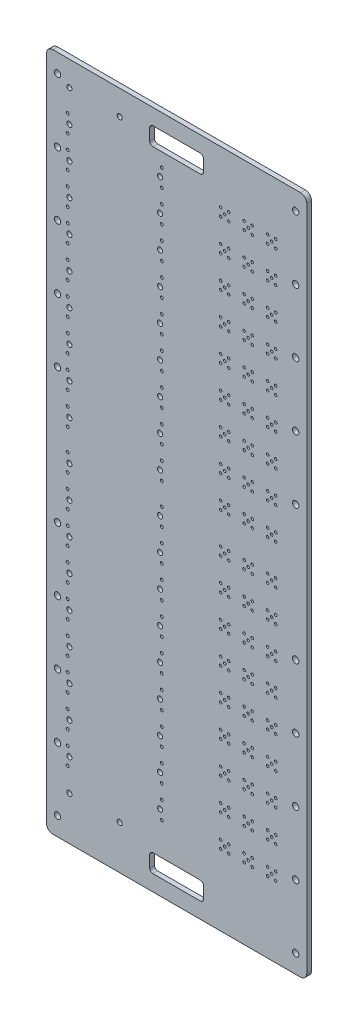
from build123d import *

# Parameters (mm, degrees)
SKETCH1_R           = 0.8
SKETCH1_R_2         = 0.45
SKETCH1_R_3         = 1
SKETCH1_R_4         = 0.4
BOSS_EXTRUDE1_DEPTH = 1.5


with BuildPart() as part:
    # Sketch1 → Boss-Extrude1 (new body)
    with BuildSketch(Plane(origin=(0, 0, 0), x_dir=(-1, 0, 0), z_dir=(0, 0, -1))):
        with BuildLine():
            Line((39, 107), (-39, 107))
            ThreePointArc((-39, 107), (-40.414213562, 106.414213562), (-41, 105))
            Line((-41, 105), (-41, -105))
            ThreePointArc((-41, -105), (-40.414213562, -106.414213562), (-39, -107))
            Line((-39, -107), (39, -107))
            ThreePointArc((39, -107), (40.414213562, -106.414213562), (41, -105))
            Line((41, -105), (41, 105))
            ThreePointArc((41, 105), (40.414213562, 106.414213562), (39, 107))
        make_face()
        with Locations(Location((5.225000014, -3.249999976, 0), (0, 0, 180))):
            Circle(SKETCH1_R, mode=Mode.SUBTRACT)
        with Locations(Location((34.325000016, -0.499999977, 0), (0, 0, 180))):
            Circle(SKETCH1_R_2, mode=Mode.SUBTRACT)
        with Locations(Location((-37.5, 101.2, 0), (0, 0, 180))):
            Circle(SKETCH1_R_3, mode=Mode.SUBTRACT)
        with Locations(Location((34.325000016, -5.999999976, 0), (0, 0, 180))):
            Circle(SKETCH1_R_2, mode=Mode.SUBTRACT)
        with Locations(Location((34.325000016, 46.500000023, 0), (0, 0, 180))):
            Circle(SKETCH1_R_2, mode=Mode.SUBTRACT)
        with Locations(Location((4.675000014, -5.999999976, 0), (0, 0, 180))):
            Circle(SKETCH1_R_2, mode=Mode.SUBTRACT)
        with Locations(Location((5.225000014, 79.250000024, 0), (0, 0, 180))):
            Circle(SKETCH1_R, mode=Mode.SUBTRACT)
        with Locations(Location((34.325000016, 82.000000023, 0), (0, 0, 180))):
            Circle(SKETCH1_R_2, mode=Mode.SUBTRACT)
        with Locations(Location((33.775000015, 19.250000024, 0), (0, 0, 180))):
            Circle(SKETCH1_R, mode=Mode.SUBTRACT)
        with Locations(Location((33.775000015, -3.249999976, 0), (0, 0, 180))):
            Circle(SKETCH1_R, mode=Mode.SUBTRACT)
        with Locations(Location((34.325000016, 26.500000023, 0), (0, 0, 180))):
            Circle(SKETCH1_R_2, mode=Mode.SUBTRACT)
        with Locations(Location((4.675000014, -0.499999977, 0), (0, 0, 180))):
            Circle(SKETCH1_R_2, mode=Mode.SUBTRACT)
        with Locations(Location((5.225000014, -13.249999976, 0), (0, 0, 180))):
            Circle(SKETCH1_R, mode=Mode.SUBTRACT)
        with Locations(Location((5.225000014, 29.250000023, 0), (0, 0, 180))):
            Circle(SKETCH1_R, mode=Mode.SUBTRACT)
        with Locations(Location((34.325000016, -10.499999977, 0), (0, 0, 180))):
            Circle(SKETCH1_R_2, mode=Mode.SUBTRACT)
        with Locations(Location((34.325000016, 36.500000023, 0), (0, 0, 180))):
            Circle(SKETCH1_R_2, mode=Mode.SUBTRACT)
        with Locations(Location((4.675000014, 22.000000023, 0), (0, 0, 180))):
            Circle(SKETCH1_R_2, mode=Mode.SUBTRACT)
        with Locations(Location((34.325000016, -15.999999976, 0), (0, 0, 180))):
            Circle(SKETCH1_R_2, mode=Mode.SUBTRACT)
        with Locations(Location((5.225000014, 19.250000023, 0), (0, 0, 180))):
            Circle(SKETCH1_R, mode=Mode.SUBTRACT)
        with Locations(Location((4.675000014, -15.999999976, 0), (0, 0, 180))):
            Circle(SKETCH1_R_2, mode=Mode.SUBTRACT)
        with Locations(Location((33.775000015, -13.249999976, 0), (0, 0, 180))):
            Circle(SKETCH1_R, mode=Mode.SUBTRACT)
        with Locations(Location((34.325000016, 76.500000024, 0), (0, 0, 180))):
            Circle(SKETCH1_R_2, mode=Mode.SUBTRACT)
        with Locations(Location((5.225000014, 89.250000024, 0), (0, 0, 180))):
            Circle(SKETCH1_R, mode=Mode.SUBTRACT)
        with Locations(Location((4.675000014, -10.499999977, 0), (0, 0, 180))):
            Circle(SKETCH1_R_2, mode=Mode.SUBTRACT)
        with Locations(Location((5.225000014, -23.249999976, 0), (0, 0, 180))):
            Circle(SKETCH1_R, mode=Mode.SUBTRACT)
        with Locations(Location((34.325000016, -20.499999977, 0), (0, 0, 180))):
            Circle(SKETCH1_R_2, mode=Mode.SUBTRACT)
        with Locations(Location((4.675000014, 76.500000024, 0), (0, 0, 180))):
            Circle(SKETCH1_R_2, mode=Mode.SUBTRACT)
        with Locations(Location((33.775000015, 79.250000024, 0), (0, 0, 180))):
            Circle(SKETCH1_R, mode=Mode.SUBTRACT)
        with Locations(Location((34.325000016, 32.000000023, 0), (0, 0, 180))):
            Circle(SKETCH1_R_2, mode=Mode.SUBTRACT)
        with Locations(Location((34.325000016, -25.999999976, 0), (0, 0, 180))):
            Circle(SKETCH1_R_2, mode=Mode.SUBTRACT)
        with Locations(Location((4.675000014, 46.500000023, 0), (0, 0, 180))):
            Circle(SKETCH1_R_2, mode=Mode.SUBTRACT)
        with Locations(Location((4.675000014, 26.500000023, 0), (0, 0, 180))):
            Circle(SKETCH1_R_2, mode=Mode.SUBTRACT)
        with Locations(Location((4.675000014, -25.999999976, 0), (0, 0, 180))):
            Circle(SKETCH1_R_2, mode=Mode.SUBTRACT)
        with Locations(Location((33.775000015, -23.249999976, 0), (0, 0, 180))):
            Circle(SKETCH1_R, mode=Mode.SUBTRACT)
        with Locations(Location((4.675000014, -20.499999977, 0), (0, 0, 180))):
            Circle(SKETCH1_R_2, mode=Mode.SUBTRACT)
        with Locations(Location((5.225000014, -33.249999976, 0), (0, 0, 180))):
            Circle(SKETCH1_R, mode=Mode.SUBTRACT)
        with Locations(Location((34.325000016, -30.499999977, 0), (0, 0, 180))):
            Circle(SKETCH1_R_2, mode=Mode.SUBTRACT)
        with Locations(Location((34.325000016, -35.999999976, 0), (0, 0, 180))):
            Circle(SKETCH1_R_2, mode=Mode.SUBTRACT)
        with Locations(Location((34.325000016, 92.000000023, 0), (0, 0, 180))):
            Circle(SKETCH1_R_2, mode=Mode.SUBTRACT)
        with Locations(Location((33.775000015, -93.249999976, 0), (0, 0, 180))):
            Circle(SKETCH1_R, mode=Mode.SUBTRACT)
        with Locations(Location((4.675000014, 32.000000023, 0), (0, 0, 180))):
            Circle(SKETCH1_R_2, mode=Mode.SUBTRACT)
        with Locations(Location((4.675000014, 16.500000023, 0), (0, 0, 180))):
            Circle(SKETCH1_R_2, mode=Mode.SUBTRACT)
        with Locations(Location((4.675000014, -35.999999976, 0), (0, 0, 180))):
            Circle(SKETCH1_R_2, mode=Mode.SUBTRACT)
        with Locations(Location((4.675000014, 82.000000023, 0), (0, 0, 180))):
            Circle(SKETCH1_R_2, mode=Mode.SUBTRACT)
        with Locations(Location((5.225000014, 69.250000024, 0), (0, 0, 180))):
            Circle(SKETCH1_R, mode=Mode.SUBTRACT)
        with Locations(Location((34.325000016, 16.500000023, 0), (0, 0, 180))):
            Circle(SKETCH1_R_2, mode=Mode.SUBTRACT)
        with Locations(Location((33.775000015, -33.249999976, 0), (0, 0, 180))):
            Circle(SKETCH1_R, mode=Mode.SUBTRACT)
        with Locations(Location((4.675000014, -30.499999977, 0), (0, 0, 180))):
            Circle(SKETCH1_R_2, mode=Mode.SUBTRACT)
        with Locations(Location((4.675000014, 36.500000023, 0), (0, 0, 180))):
            Circle(SKETCH1_R_2, mode=Mode.SUBTRACT)
        with Locations(Location((5.225000014, -43.249999976, 0), (0, 0, 180))):
            Circle(SKETCH1_R, mode=Mode.SUBTRACT)
        with Locations(Location((34.325000016, 86.500000024, 0), (0, 0, 180))):
            Circle(SKETCH1_R_2, mode=Mode.SUBTRACT)
        with Locations(Location((33.775000015, 29.250000024, 0), (0, 0, 180))):
            Circle(SKETCH1_R, mode=Mode.SUBTRACT)
        with Locations(Location((34.325000016, -40.499999977, 0), (0, 0, 180))):
            Circle(SKETCH1_R_2, mode=Mode.SUBTRACT)
        with Locations(Location((34.325000016, -45.999999976, 0), (0, 0, 180))):
            Circle(SKETCH1_R_2, mode=Mode.SUBTRACT)
        with Locations(Location((4.675000014, -45.999999976, 0), (0, 0, 180))):
            Circle(SKETCH1_R_2, mode=Mode.SUBTRACT)
        with Locations(Location((33.775000015, 39.250000024, 0), (0, 0, 180))):
            Circle(SKETCH1_R, mode=Mode.SUBTRACT)
        with Locations(Location((34.325000016, 72.000000023, 0), (0, 0, 180))):
            Circle(SKETCH1_R_2, mode=Mode.SUBTRACT)
        with Locations(Location((34.325000016, 12.000000023, 0), (0, 0, 180))):
            Circle(SKETCH1_R_2, mode=Mode.SUBTRACT)
        with Locations(Location((33.775000015, -43.249999976, 0), (0, 0, 180))):
            Circle(SKETCH1_R, mode=Mode.SUBTRACT)
        with Locations(Location((4.675000014, -40.499999977, 0), (0, 0, 180))):
            Circle(SKETCH1_R_2, mode=Mode.SUBTRACT)
        with Locations(Location((34.325000016, 66.500000024, 0), (0, 0, 180))):
            Circle(SKETCH1_R_2, mode=Mode.SUBTRACT)
        with Locations(Location((5.225000014, -53.249999976, 0), (0, 0, 180))):
            Circle(SKETCH1_R, mode=Mode.SUBTRACT)
        with Locations(Location((33.775000015, 9.250000024, 0), (0, 0, 180))):
            Circle(SKETCH1_R, mode=Mode.SUBTRACT)
        with Locations(Location((34.325000016, -50.499999977, 0), (0, 0, 180))):
            Circle(SKETCH1_R_2, mode=Mode.SUBTRACT)
        with Locations(Location((34.325000016, -55.999999976, 0), (0, 0, 180))):
            Circle(SKETCH1_R_2, mode=Mode.SUBTRACT)
        with Locations(Location((4.675000014, -55.999999976, 0), (0, 0, 180))):
            Circle(SKETCH1_R_2, mode=Mode.SUBTRACT)
        with Locations(Location((33.775000015, -53.249999976, 0), (0, 0, 180))):
            Circle(SKETCH1_R, mode=Mode.SUBTRACT)
        with Locations(Location((4.675000014, 66.500000024, 0), (0, 0, 180))):
            Circle(SKETCH1_R_2, mode=Mode.SUBTRACT)
        with Locations(Location((4.675000014, -50.499999977, 0), (0, 0, 180))):
            Circle(SKETCH1_R_2, mode=Mode.SUBTRACT)
        with Locations(Location((33.775000015, 99.250000024, 0), (0, 0, 180))):
            Circle(SKETCH1_R, mode=Mode.SUBTRACT)
        with Locations(Location((5.225000014, -63.249999976, 0), (0, 0, 180))):
            Circle(SKETCH1_R, mode=Mode.SUBTRACT)
        with Locations(Location((33.775000015, 69.250000024, 0), (0, 0, 180))):
            Circle(SKETCH1_R, mode=Mode.SUBTRACT)
        with Locations(Location((-37.5, 21.2, 0), (0, 0, 180))):
            Circle(SKETCH1_R_3, mode=Mode.SUBTRACT)
        with Locations(Location((4.675000014, 72.000000023, 0), (0, 0, 180))):
            Circle(SKETCH1_R_2, mode=Mode.SUBTRACT)
        with Locations(Location((34.325000016, -60.499999977, 0), (0, 0, 180))):
            Circle(SKETCH1_R_2, mode=Mode.SUBTRACT)
        with Locations(Location((5.225000014, 59.250000024, 0), (0, 0, 180))):
            Circle(SKETCH1_R, mode=Mode.SUBTRACT)
        with Locations(Location((4.675000014, 86.500000024, 0), (0, 0, 180))):
            Circle(SKETCH1_R_2, mode=Mode.SUBTRACT)
        with Locations(Location((34.325000016, -65.999999976, 0), (0, 0, 180))):
            Circle(SKETCH1_R_2, mode=Mode.SUBTRACT)
        with Locations(Location((4.675000014, 6.500000023, 0), (0, 0, 180))):
            Circle(SKETCH1_R_2, mode=Mode.SUBTRACT)
        with Locations(Location((34.325000016, 62.000000023, 0), (0, 0, 180))):
            Circle(SKETCH1_R_2, mode=Mode.SUBTRACT)
        with Locations(Location((4.675000014, -65.999999976, 0), (0, 0, 180))):
            Circle(SKETCH1_R_2, mode=Mode.SUBTRACT)
        with Locations(Location((33.775000015, -63.249999976, 0), (0, 0, 180))):
            Circle(SKETCH1_R, mode=Mode.SUBTRACT)
        with Locations(Location((4.675000014, 42.000000023, 0), (0, 0, 180))):
            Circle(SKETCH1_R_2, mode=Mode.SUBTRACT)
        with Locations(Location((4.675000014, -60.499999977, 0), (0, 0, 180))):
            Circle(SKETCH1_R_2, mode=Mode.SUBTRACT)
        with Locations(Location((34.325000016, 56.500000024, 0), (0, 0, 180))):
            Circle(SKETCH1_R_2, mode=Mode.SUBTRACT)
        with Locations(Location((4.675000014, 56.500000024, 0), (0, 0, 180))):
            Circle(SKETCH1_R_2, mode=Mode.SUBTRACT)
        with Locations(Location((5.225000014, -73.249999976, 0), (0, 0, 180))):
            Circle(SKETCH1_R, mode=Mode.SUBTRACT)
        with Locations(Location((33.775000015, 89.250000024, 0), (0, 0, 180))):
            Circle(SKETCH1_R, mode=Mode.SUBTRACT)
        with Locations(Location((17.925000011, -93.249999976, 0), (0, 0, 180))):
            Circle(SKETCH1_R, mode=Mode.SUBTRACT)
        with Locations(Location((34.325000016, 22.000000023, 0), (0, 0, 180))):
            Circle(SKETCH1_R_2, mode=Mode.SUBTRACT)
        with Locations(Location((33.775000015, 59.250000024, 0), (0, 0, 180))):
            Circle(SKETCH1_R, mode=Mode.SUBTRACT)
        with Locations(Location((17.925000011, 99.250000024, 0), (0, 0, 180))):
            Circle(SKETCH1_R, mode=Mode.SUBTRACT)
        with Locations(Location((4.675000014, 12.000000023, 0), (0, 0, 180))):
            Circle(SKETCH1_R_2, mode=Mode.SUBTRACT)
        with Locations(Location((34.325000016, -70.499999977, 0), (0, 0, 180))):
            Circle(SKETCH1_R_2, mode=Mode.SUBTRACT)
        with Locations(Location((4.675000014, 62.000000023, 0), (0, 0, 180))):
            Circle(SKETCH1_R_2, mode=Mode.SUBTRACT)
        with Locations(Location((34.325000016, -75.999999976, 0), (0, 0, 180))):
            Circle(SKETCH1_R_2, mode=Mode.SUBTRACT)
        with Locations(Location((4.675000014, -75.999999976, 0), (0, 0, 180))):
            Circle(SKETCH1_R_2, mode=Mode.SUBTRACT)
        with Locations(Location((5.225000014, 39.250000023, 0), (0, 0, 180))):
            Circle(SKETCH1_R, mode=Mode.SUBTRACT)
        with Locations(Location((33.775000015, -73.249999976, 0), (0, 0, 180))):
            Circle(SKETCH1_R, mode=Mode.SUBTRACT)
        with Locations(Location((4.675000014, -70.499999977, 0), (0, 0, 180))):
            Circle(SKETCH1_R_2, mode=Mode.SUBTRACT)
        with Locations(Location((-21.27, -12.07885, 0), (0, 0, 180))):
            Circle(SKETCH1_R_4, mode=Mode.SUBTRACT)
        with Locations(Location((-23.81, -12.07885, 0), (0, 0, 180))):
            Circle(SKETCH1_R_4, mode=Mode.SUBTRACT)
        with Locations(Location((-23.81, -14.61885, 0), (0, 0, 180))):
            Circle(SKETCH1_R_4, mode=Mode.SUBTRACT)
        with Locations(Location((-22.54, -13.34885, 0), (0, 0, 180))):
            Circle(SKETCH1_R_4, mode=Mode.SUBTRACT)
        with Locations(Location((-21.27, -14.61885, 0), (0, 0, 180))):
            Circle(SKETCH1_R_4, mode=Mode.SUBTRACT)
        with Locations(Location((37.5, -21.2, 0), (0, 0, 180))):
            Circle(SKETCH1_R_3, mode=Mode.SUBTRACT)
        with Locations(Location((-28.67, -12.07885, 0), (0, 0, 180))):
            Circle(SKETCH1_R_4, mode=Mode.SUBTRACT)
        with Locations(Location((-31.21, -12.07885, 0), (0, 0, 180))):
            Circle(SKETCH1_R_4, mode=Mode.SUBTRACT)
        with Locations(Location((-31.21, -14.61885, 0), (0, 0, 180))):
            Circle(SKETCH1_R_4, mode=Mode.SUBTRACT)
        with Locations(Location((-29.94, -13.34885, 0), (0, 0, 180))):
            Circle(SKETCH1_R_4, mode=Mode.SUBTRACT)
        with Locations(Location((-28.67, -14.61885, 0), (0, 0, 180))):
            Circle(SKETCH1_R_4, mode=Mode.SUBTRACT)
        with Locations(Location((-13.87, -12.07885, 0), (0, 0, 180))):
            Circle(SKETCH1_R_4, mode=Mode.SUBTRACT)
        with Locations(Location((-16.41, -12.07885, 0), (0, 0, 180))):
            Circle(SKETCH1_R_4, mode=Mode.SUBTRACT)
        with Locations(Location((-16.41, -14.61885, 0), (0, 0, 180))):
            Circle(SKETCH1_R_4, mode=Mode.SUBTRACT)
        with Locations(Location((-15.14, -13.34885, 0), (0, 0, 180))):
            Circle(SKETCH1_R_4, mode=Mode.SUBTRACT)
        with Locations(Location((-13.87, -14.61885, 0), (0, 0, 180))):
            Circle(SKETCH1_R_4, mode=Mode.SUBTRACT)
        with Locations(Location((-21.27, -22.07885, 0), (0, 0, 180))):
            Circle(SKETCH1_R_4, mode=Mode.SUBTRACT)
        with Locations(Location((-23.81, -22.07885, 0), (0, 0, 180))):
            Circle(SKETCH1_R_4, mode=Mode.SUBTRACT)
        with Locations(Location((-23.81, -24.61885, 0), (0, 0, 180))):
            Circle(SKETCH1_R_4, mode=Mode.SUBTRACT)
        with Locations(Location((-22.54, -23.34885, 0), (0, 0, 180))):
            Circle(SKETCH1_R_4, mode=Mode.SUBTRACT)
        with Locations(Location((-21.27, -24.61885, 0), (0, 0, 180))):
            Circle(SKETCH1_R_4, mode=Mode.SUBTRACT)
        with Locations(Location((-28.67, -22.07885, 0), (0, 0, 180))):
            Circle(SKETCH1_R_4, mode=Mode.SUBTRACT)
        with Locations(Location((-31.21, -22.07885, 0), (0, 0, 180))):
            Circle(SKETCH1_R_4, mode=Mode.SUBTRACT)
        with Locations(Location((-31.21, -24.61885, 0), (0, 0, 180))):
            Circle(SKETCH1_R_4, mode=Mode.SUBTRACT)
        with Locations(Location((-29.94, -23.34885, 0), (0, 0, 180))):
            Circle(SKETCH1_R_4, mode=Mode.SUBTRACT)
        with Locations(Location((-28.67, -24.61885, 0), (0, 0, 180))):
            Circle(SKETCH1_R_4, mode=Mode.SUBTRACT)
        with Locations(Location((-13.87, -22.07885, 0), (0, 0, 180))):
            Circle(SKETCH1_R_4, mode=Mode.SUBTRACT)
        with Locations(Location((-16.41, -22.07885, 0), (0, 0, 180))):
            Circle(SKETCH1_R_4, mode=Mode.SUBTRACT)
        with Locations(Location((-16.41, -24.61885, 0), (0, 0, 180))):
            Circle(SKETCH1_R_4, mode=Mode.SUBTRACT)
        with Locations(Location((-15.14, -23.34885, 0), (0, 0, 180))):
            Circle(SKETCH1_R_4, mode=Mode.SUBTRACT)
        with Locations(Location((-13.87, -24.61885, 0), (0, 0, 180))):
            Circle(SKETCH1_R_4, mode=Mode.SUBTRACT)
        with Locations(Location((-21.27, -32.07885, 0), (0, 0, 180))):
            Circle(SKETCH1_R_4, mode=Mode.SUBTRACT)
        with Locations(Location((-23.81, -32.07885, 0), (0, 0, 180))):
            Circle(SKETCH1_R_4, mode=Mode.SUBTRACT)
        with Locations(Location((-23.81, -34.61885, 0), (0, 0, 180))):
            Circle(SKETCH1_R_4, mode=Mode.SUBTRACT)
        with Locations(Location((-22.54, -33.34885, 0), (0, 0, 180))):
            Circle(SKETCH1_R_4, mode=Mode.SUBTRACT)
        with Locations(Location((-21.27, -34.61885, 0), (0, 0, 180))):
            Circle(SKETCH1_R_4, mode=Mode.SUBTRACT)
        with Locations(Location((-28.67, -32.07885, 0), (0, 0, 180))):
            Circle(SKETCH1_R_4, mode=Mode.SUBTRACT)
        with Locations(Location((-31.21, -32.07885, 0), (0, 0, 180))):
            Circle(SKETCH1_R_4, mode=Mode.SUBTRACT)
        with Locations(Location((-31.21, -34.61885, 0), (0, 0, 180))):
            Circle(SKETCH1_R_4, mode=Mode.SUBTRACT)
        with Locations(Location((-29.94, -33.34885, 0), (0, 0, 180))):
            Circle(SKETCH1_R_4, mode=Mode.SUBTRACT)
        with Locations(Location((-28.67, -34.61885, 0), (0, 0, 180))):
            Circle(SKETCH1_R_4, mode=Mode.SUBTRACT)
        with Locations(Location((-13.87, -32.07885, 0), (0, 0, 180))):
            Circle(SKETCH1_R_4, mode=Mode.SUBTRACT)
        with Locations(Location((-16.41, -32.07885, 0), (0, 0, 180))):
            Circle(SKETCH1_R_4, mode=Mode.SUBTRACT)
        with Locations(Location((-16.41, -34.61885, 0), (0, 0, 180))):
            Circle(SKETCH1_R_4, mode=Mode.SUBTRACT)
        with Locations(Location((-15.14, -33.34885, 0), (0, 0, 180))):
            Circle(SKETCH1_R_4, mode=Mode.SUBTRACT)
        with Locations(Location((-13.87, -34.61885, 0), (0, 0, 180))):
            Circle(SKETCH1_R_4, mode=Mode.SUBTRACT)
        with Locations(Location((-21.27, -42.07885, 0), (0, 0, 180))):
            Circle(SKETCH1_R_4, mode=Mode.SUBTRACT)
        with Locations(Location((-23.81, -42.07885, 0), (0, 0, 180))):
            Circle(SKETCH1_R_4, mode=Mode.SUBTRACT)
        with Locations(Location((-23.81, -44.61885, 0), (0, 0, 180))):
            Circle(SKETCH1_R_4, mode=Mode.SUBTRACT)
        with Locations(Location((-22.54, -43.34885, 0), (0, 0, 180))):
            Circle(SKETCH1_R_4, mode=Mode.SUBTRACT)
        with Locations(Location((-21.27, -44.61885, 0), (0, 0, 180))):
            Circle(SKETCH1_R_4, mode=Mode.SUBTRACT)
        with Locations(Location((-28.67, -42.07885, 0), (0, 0, 180))):
            Circle(SKETCH1_R_4, mode=Mode.SUBTRACT)
        with Locations(Location((-31.21, -42.07885, 0), (0, 0, 180))):
            Circle(SKETCH1_R_4, mode=Mode.SUBTRACT)
        with Locations(Location((-31.21, -44.61885, 0), (0, 0, 180))):
            Circle(SKETCH1_R_4, mode=Mode.SUBTRACT)
        with Locations(Location((-29.94, -43.34885, 0), (0, 0, 180))):
            Circle(SKETCH1_R_4, mode=Mode.SUBTRACT)
        with Locations(Location((-21.27, 80.42115, 0), (0, 0, 180))):
            Circle(SKETCH1_R_4, mode=Mode.SUBTRACT)
        with Locations(Location((-23.81, 80.42115, 0), (0, 0, 180))):
            Circle(SKETCH1_R_4, mode=Mode.SUBTRACT)
        with Locations(Location((-23.81, 77.88115, 0), (0, 0, 180))):
            Circle(SKETCH1_R_4, mode=Mode.SUBTRACT)
        with Locations(Location((-22.54, 79.15115, 0), (0, 0, 180))):
            Circle(SKETCH1_R_4, mode=Mode.SUBTRACT)
        with Locations(Location((-21.27, 77.88115, 0), (0, 0, 180))):
            Circle(SKETCH1_R_4, mode=Mode.SUBTRACT)
        with Locations(Location((-28.67, 80.42115, 0), (0, 0, 180))):
            Circle(SKETCH1_R_4, mode=Mode.SUBTRACT)
        with Locations(Location((-31.21, 80.42115, 0), (0, 0, 180))):
            Circle(SKETCH1_R_4, mode=Mode.SUBTRACT)
        with Locations(Location((-31.21, 77.88115, 0), (0, 0, 180))):
            Circle(SKETCH1_R_4, mode=Mode.SUBTRACT)
        with Locations(Location((-29.94, 79.15115, 0), (0, 0, 180))):
            Circle(SKETCH1_R_4, mode=Mode.SUBTRACT)
        with Locations(Location((-28.67, 77.88115, 0), (0, 0, 180))):
            Circle(SKETCH1_R_4, mode=Mode.SUBTRACT)
        with Locations(Location((-28.67, -44.61885, 0), (0, 0, 180))):
            Circle(SKETCH1_R_4, mode=Mode.SUBTRACT)
        with Locations(Location((-13.87, -42.07885, 0), (0, 0, 180))):
            Circle(SKETCH1_R_4, mode=Mode.SUBTRACT)
        with Locations(Location((-16.41, -42.07885, 0), (0, 0, 180))):
            Circle(SKETCH1_R_4, mode=Mode.SUBTRACT)
        with Locations(Location((-16.41, -44.61885, 0), (0, 0, 180))):
            Circle(SKETCH1_R_4, mode=Mode.SUBTRACT)
        with Locations(Location((-15.14, -43.34885, 0), (0, 0, 180))):
            Circle(SKETCH1_R_4, mode=Mode.SUBTRACT)
        with Locations(Location((-13.87, -44.61885, 0), (0, 0, 180))):
            Circle(SKETCH1_R_4, mode=Mode.SUBTRACT)
        with Locations(Location((-21.27, -52.07885, 0), (0, 0, 180))):
            Circle(SKETCH1_R_4, mode=Mode.SUBTRACT)
        with Locations(Location((-23.81, -52.07885, 0), (0, 0, 180))):
            Circle(SKETCH1_R_4, mode=Mode.SUBTRACT)
        with Locations(Location((-23.81, -54.61885, 0), (0, 0, 180))):
            Circle(SKETCH1_R_4, mode=Mode.SUBTRACT)
        with Locations(Location((-22.54, -53.34885, 0), (0, 0, 180))):
            Circle(SKETCH1_R_4, mode=Mode.SUBTRACT)
        with Locations(Location((-21.27, -54.61885, 0), (0, 0, 180))):
            Circle(SKETCH1_R_4, mode=Mode.SUBTRACT)
        with Locations(Location((-28.67, -52.07885, 0), (0, 0, 180))):
            Circle(SKETCH1_R_4, mode=Mode.SUBTRACT)
        with Locations(Location((-31.21, -52.07885, 0), (0, 0, 180))):
            Circle(SKETCH1_R_4, mode=Mode.SUBTRACT)
        with Locations(Location((-31.21, -54.61885, 0), (0, 0, 180))):
            Circle(SKETCH1_R_4, mode=Mode.SUBTRACT)
        with Locations(Location((-29.94, -53.34885, 0), (0, 0, 180))):
            Circle(SKETCH1_R_4, mode=Mode.SUBTRACT)
        with Locations(Location((-13.87, 80.42115, 0), (0, 0, 180))):
            Circle(SKETCH1_R_4, mode=Mode.SUBTRACT)
        with Locations(Location((-16.41, 80.42115, 0), (0, 0, 180))):
            Circle(SKETCH1_R_4, mode=Mode.SUBTRACT)
        with Locations(Location((-16.41, 77.88115, 0), (0, 0, 180))):
            Circle(SKETCH1_R_4, mode=Mode.SUBTRACT)
        with Locations(Location((-15.14, 79.15115, 0), (0, 0, 180))):
            Circle(SKETCH1_R_4, mode=Mode.SUBTRACT)
        with Locations(Location((-13.87, 77.88115, 0), (0, 0, 180))):
            Circle(SKETCH1_R_4, mode=Mode.SUBTRACT)
        with Locations(Location((-21.27, 70.42115, 0), (0, 0, 180))):
            Circle(SKETCH1_R_4, mode=Mode.SUBTRACT)
        with Locations(Location((-23.81, 70.42115, 0), (0, 0, 180))):
            Circle(SKETCH1_R_4, mode=Mode.SUBTRACT)
        with Locations(Location((-23.81, 67.88115, 0), (0, 0, 180))):
            Circle(SKETCH1_R_4, mode=Mode.SUBTRACT)
        with Locations(Location((-22.54, 69.15115, 0), (0, 0, 180))):
            Circle(SKETCH1_R_4, mode=Mode.SUBTRACT)
        with Locations(Location((-21.27, 67.88115, 0), (0, 0, 180))):
            Circle(SKETCH1_R_4, mode=Mode.SUBTRACT)
        with Locations(Location((-28.67, 70.42115, 0), (0, 0, 180))):
            Circle(SKETCH1_R_4, mode=Mode.SUBTRACT)
        with Locations(Location((-31.21, 70.42115, 0), (0, 0, 180))):
            Circle(SKETCH1_R_4, mode=Mode.SUBTRACT)
        with Locations(Location((-31.21, 67.88115, 0), (0, 0, 180))):
            Circle(SKETCH1_R_4, mode=Mode.SUBTRACT)
        with Locations(Location((-29.94, 69.15115, 0), (0, 0, 180))):
            Circle(SKETCH1_R_4, mode=Mode.SUBTRACT)
        with Locations(Location((-28.67, 67.88115, 0), (0, 0, 180))):
            Circle(SKETCH1_R_4, mode=Mode.SUBTRACT)
        with Locations(Location((-13.87, 70.42115, 0), (0, 0, 180))):
            Circle(SKETCH1_R_4, mode=Mode.SUBTRACT)
        with Locations(Location((-16.41, 70.42115, 0), (0, 0, 180))):
            Circle(SKETCH1_R_4, mode=Mode.SUBTRACT)
        with Locations(Location((-16.41, 67.88115, 0), (0, 0, 180))):
            Circle(SKETCH1_R_4, mode=Mode.SUBTRACT)
        with Locations(Location((-15.14, 69.15115, 0), (0, 0, 180))):
            Circle(SKETCH1_R_4, mode=Mode.SUBTRACT)
        with Locations(Location((-13.87, 67.88115, 0), (0, 0, 180))):
            Circle(SKETCH1_R_4, mode=Mode.SUBTRACT)
        with Locations(Location((-21.27, 60.42115, 0), (0, 0, 180))):
            Circle(SKETCH1_R_4, mode=Mode.SUBTRACT)
        with Locations(Location((-23.81, 60.42115, 0), (0, 0, 180))):
            Circle(SKETCH1_R_4, mode=Mode.SUBTRACT)
        with Locations(Location((-23.81, 57.88115, 0), (0, 0, 180))):
            Circle(SKETCH1_R_4, mode=Mode.SUBTRACT)
        with Locations(Location((-22.54, 59.15115, 0), (0, 0, 180))):
            Circle(SKETCH1_R_4, mode=Mode.SUBTRACT)
        with Locations(Location((-21.27, 57.88115, 0), (0, 0, 180))):
            Circle(SKETCH1_R_4, mode=Mode.SUBTRACT)
        with Locations(Location((-28.67, 60.42115, 0), (0, 0, 180))):
            Circle(SKETCH1_R_4, mode=Mode.SUBTRACT)
        with Locations(Location((-31.21, 60.42115, 0), (0, 0, 180))):
            Circle(SKETCH1_R_4, mode=Mode.SUBTRACT)
        with Locations(Location((-31.21, 57.88115, 0), (0, 0, 180))):
            Circle(SKETCH1_R_4, mode=Mode.SUBTRACT)
        with Locations(Location((-29.94, 59.15115, 0), (0, 0, 180))):
            Circle(SKETCH1_R_4, mode=Mode.SUBTRACT)
        with Locations(Location((-28.67, 57.88115, 0), (0, 0, 180))):
            Circle(SKETCH1_R_4, mode=Mode.SUBTRACT)
        with Locations(Location((-13.87, 60.42115, 0), (0, 0, 180))):
            Circle(SKETCH1_R_4, mode=Mode.SUBTRACT)
        with Locations(Location((-16.41, 60.42115, 0), (0, 0, 180))):
            Circle(SKETCH1_R_4, mode=Mode.SUBTRACT)
        with Locations(Location((-16.41, 57.88115, 0), (0, 0, 180))):
            Circle(SKETCH1_R_4, mode=Mode.SUBTRACT)
        with Locations(Location((-15.14, 59.15115, 0), (0, 0, 180))):
            Circle(SKETCH1_R_4, mode=Mode.SUBTRACT)
        with Locations(Location((-13.87, 57.88115, 0), (0, 0, 180))):
            Circle(SKETCH1_R_4, mode=Mode.SUBTRACT)
        with Locations(Location((-21.27, 50.42115, 0), (0, 0, 180))):
            Circle(SKETCH1_R_4, mode=Mode.SUBTRACT)
        with Locations(Location((-23.81, 50.42115, 0), (0, 0, 180))):
            Circle(SKETCH1_R_4, mode=Mode.SUBTRACT)
        with Locations(Location((-23.81, 47.88115, 0), (0, 0, 180))):
            Circle(SKETCH1_R_4, mode=Mode.SUBTRACT)
        with Locations(Location((-22.54, 49.15115, 0), (0, 0, 180))):
            Circle(SKETCH1_R_4, mode=Mode.SUBTRACT)
        with Locations(Location((-21.27, 47.88115, 0), (0, 0, 180))):
            Circle(SKETCH1_R_4, mode=Mode.SUBTRACT)
        with Locations(Location((-28.67, -54.61885, 0), (0, 0, 180))):
            Circle(SKETCH1_R_4, mode=Mode.SUBTRACT)
        with Locations(Location((-13.87, -52.07885, 0), (0, 0, 180))):
            Circle(SKETCH1_R_4, mode=Mode.SUBTRACT)
        with Locations(Location((-16.41, -52.07885, 0), (0, 0, 180))):
            Circle(SKETCH1_R_4, mode=Mode.SUBTRACT)
        with Locations(Location((-16.41, -54.61885, 0), (0, 0, 180))):
            Circle(SKETCH1_R_4, mode=Mode.SUBTRACT)
        with Locations(Location((-15.14, -53.34885, 0), (0, 0, 180))):
            Circle(SKETCH1_R_4, mode=Mode.SUBTRACT)
        with Locations(Location((-13.87, -54.61885, 0), (0, 0, 180))):
            Circle(SKETCH1_R_4, mode=Mode.SUBTRACT)
        with Locations(Location((-21.27, -62.07885, 0), (0, 0, 180))):
            Circle(SKETCH1_R_4, mode=Mode.SUBTRACT)
        with Locations(Location((-23.81, -62.07885, 0), (0, 0, 180))):
            Circle(SKETCH1_R_4, mode=Mode.SUBTRACT)
        with Locations(Location((-23.81, -64.61885, 0), (0, 0, 180))):
            Circle(SKETCH1_R_4, mode=Mode.SUBTRACT)
        with Locations(Location((-22.54, -63.34885, 0), (0, 0, 180))):
            Circle(SKETCH1_R_4, mode=Mode.SUBTRACT)
        with Locations(Location((-21.27, -64.61885, 0), (0, 0, 180))):
            Circle(SKETCH1_R_4, mode=Mode.SUBTRACT)
        with Locations(Location((-28.67, -62.07885, 0), (0, 0, 180))):
            Circle(SKETCH1_R_4, mode=Mode.SUBTRACT)
        with Locations(Location((-31.21, -62.07885, 0), (0, 0, 180))):
            Circle(SKETCH1_R_4, mode=Mode.SUBTRACT)
        with Locations(Location((-31.21, -64.61885, 0), (0, 0, 180))):
            Circle(SKETCH1_R_4, mode=Mode.SUBTRACT)
        with Locations(Location((-29.94, -63.34885, 0), (0, 0, 180))):
            Circle(SKETCH1_R_4, mode=Mode.SUBTRACT)
        with Locations(Location((-28.67, 50.42115, 0), (0, 0, 180))):
            Circle(SKETCH1_R_4, mode=Mode.SUBTRACT)
        with Locations(Location((-31.21, 50.42115, 0), (0, 0, 180))):
            Circle(SKETCH1_R_4, mode=Mode.SUBTRACT)
        with Locations(Location((-31.21, 47.88115, 0), (0, 0, 180))):
            Circle(SKETCH1_R_4, mode=Mode.SUBTRACT)
        with Locations(Location((-29.94, 49.15115, 0), (0, 0, 180))):
            Circle(SKETCH1_R_4, mode=Mode.SUBTRACT)
        with Locations(Location((-28.67, 47.88115, 0), (0, 0, 180))):
            Circle(SKETCH1_R_4, mode=Mode.SUBTRACT)
        with Locations(Location((-13.87, 50.42115, 0), (0, 0, 180))):
            Circle(SKETCH1_R_4, mode=Mode.SUBTRACT)
        with Locations(Location((-16.41, 50.42115, 0), (0, 0, 180))):
            Circle(SKETCH1_R_4, mode=Mode.SUBTRACT)
        with Locations(Location((-16.41, 47.88115, 0), (0, 0, 180))):
            Circle(SKETCH1_R_4, mode=Mode.SUBTRACT)
        with Locations(Location((-15.14, 49.15115, 0), (0, 0, 180))):
            Circle(SKETCH1_R_4, mode=Mode.SUBTRACT)
        with Locations(Location((-13.87, 47.88115, 0), (0, 0, 180))):
            Circle(SKETCH1_R_4, mode=Mode.SUBTRACT)
        with Locations(Location((-21.27, 40.42115, 0), (0, 0, 180))):
            Circle(SKETCH1_R_4, mode=Mode.SUBTRACT)
        with Locations(Location((-23.81, 40.42115, 0), (0, 0, 180))):
            Circle(SKETCH1_R_4, mode=Mode.SUBTRACT)
        with Locations(Location((-23.81, 37.88115, 0), (0, 0, 180))):
            Circle(SKETCH1_R_4, mode=Mode.SUBTRACT)
        with Locations(Location((-22.54, 39.15115, 0), (0, 0, 180))):
            Circle(SKETCH1_R_4, mode=Mode.SUBTRACT)
        with Locations(Location((-21.27, 37.88115, 0), (0, 0, 180))):
            Circle(SKETCH1_R_4, mode=Mode.SUBTRACT)
        with Locations(Location((-28.67, 40.42115, 0), (0, 0, 180))):
            Circle(SKETCH1_R_4, mode=Mode.SUBTRACT)
        with Locations(Location((-31.21, 40.42115, 0), (0, 0, 180))):
            Circle(SKETCH1_R_4, mode=Mode.SUBTRACT)
        with Locations(Location((-31.21, 37.88115, 0), (0, 0, 180))):
            Circle(SKETCH1_R_4, mode=Mode.SUBTRACT)
        with Locations(Location((-29.94, 39.15115, 0), (0, 0, 180))):
            Circle(SKETCH1_R_4, mode=Mode.SUBTRACT)
        with Locations(Location((-28.67, 37.88115, 0), (0, 0, 180))):
            Circle(SKETCH1_R_4, mode=Mode.SUBTRACT)
        with Locations(Location((-13.87, 40.42115, 0), (0, 0, 180))):
            Circle(SKETCH1_R_4, mode=Mode.SUBTRACT)
        with Locations(Location((-16.41, 40.42115, 0), (0, 0, 180))):
            Circle(SKETCH1_R_4, mode=Mode.SUBTRACT)
        with Locations(Location((-16.41, 37.88115, 0), (0, 0, 180))):
            Circle(SKETCH1_R_4, mode=Mode.SUBTRACT)
        with Locations(Location((-15.14, 39.15115, 0), (0, 0, 180))):
            Circle(SKETCH1_R_4, mode=Mode.SUBTRACT)
        with Locations(Location((-13.87, 37.88115, 0), (0, 0, 180))):
            Circle(SKETCH1_R_4, mode=Mode.SUBTRACT)
        with Locations(Location((-21.27, 30.42115, 0), (0, 0, 180))):
            Circle(SKETCH1_R_4, mode=Mode.SUBTRACT)
        with Locations(Location((-23.81, 30.42115, 0), (0, 0, 180))):
            Circle(SKETCH1_R_4, mode=Mode.SUBTRACT)
        with Locations(Location((-23.81, 27.88115, 0), (0, 0, 180))):
            Circle(SKETCH1_R_4, mode=Mode.SUBTRACT)
        with Locations(Location((-22.54, 29.15115, 0), (0, 0, 180))):
            Circle(SKETCH1_R_4, mode=Mode.SUBTRACT)
        with Locations(Location((-21.27, 27.88115, 0), (0, 0, 180))):
            Circle(SKETCH1_R_4, mode=Mode.SUBTRACT)
        with Locations(Location((-28.67, 30.42115, 0), (0, 0, 180))):
            Circle(SKETCH1_R_4, mode=Mode.SUBTRACT)
        with Locations(Location((-31.21, 30.42115, 0), (0, 0, 180))):
            Circle(SKETCH1_R_4, mode=Mode.SUBTRACT)
        with Locations(Location((-31.21, 27.88115, 0), (0, 0, 180))):
            Circle(SKETCH1_R_4, mode=Mode.SUBTRACT)
        with Locations(Location((-29.94, 29.15115, 0), (0, 0, 180))):
            Circle(SKETCH1_R_4, mode=Mode.SUBTRACT)
        with Locations(Location((-28.67, 27.88115, 0), (0, 0, 180))):
            Circle(SKETCH1_R_4, mode=Mode.SUBTRACT)
        with Locations(Location((-13.87, 30.42115, 0), (0, 0, 180))):
            Circle(SKETCH1_R_4, mode=Mode.SUBTRACT)
        with Locations(Location((-16.41, 30.42115, 0), (0, 0, 180))):
            Circle(SKETCH1_R_4, mode=Mode.SUBTRACT)
        with Locations(Location((-16.41, 27.88115, 0), (0, 0, 180))):
            Circle(SKETCH1_R_4, mode=Mode.SUBTRACT)
        with Locations(Location((-15.14, 29.15115, 0), (0, 0, 180))):
            Circle(SKETCH1_R_4, mode=Mode.SUBTRACT)
        with Locations(Location((-13.87, 27.88115, 0), (0, 0, 180))):
            Circle(SKETCH1_R_4, mode=Mode.SUBTRACT)
        with Locations(Location((-28.67, -64.61885, 0), (0, 0, 180))):
            Circle(SKETCH1_R_4, mode=Mode.SUBTRACT)
        with Locations(Location((-13.87, -62.07885, 0), (0, 0, 180))):
            Circle(SKETCH1_R_4, mode=Mode.SUBTRACT)
        with Locations(Location((-16.41, -62.07885, 0), (0, 0, 180))):
            Circle(SKETCH1_R_4, mode=Mode.SUBTRACT)
        with Locations(Location((-16.41, -64.61885, 0), (0, 0, 180))):
            Circle(SKETCH1_R_4, mode=Mode.SUBTRACT)
        with Locations(Location((-15.14, -63.34885, 0), (0, 0, 180))):
            Circle(SKETCH1_R_4, mode=Mode.SUBTRACT)
        with Locations(Location((-13.87, -64.61885, 0), (0, 0, 180))):
            Circle(SKETCH1_R_4, mode=Mode.SUBTRACT)
        with Locations(Location((-21.27, -72.07885, 0), (0, 0, 180))):
            Circle(SKETCH1_R_4, mode=Mode.SUBTRACT)
        with Locations(Location((-23.81, -72.07885, 0), (0, 0, 180))):
            Circle(SKETCH1_R_4, mode=Mode.SUBTRACT)
        with Locations(Location((-23.81, -74.61885, 0), (0, 0, 180))):
            Circle(SKETCH1_R_4, mode=Mode.SUBTRACT)
        with Locations(Location((-22.54, -73.34885, 0), (0, 0, 180))):
            Circle(SKETCH1_R_4, mode=Mode.SUBTRACT)
        with Locations(Location((-21.27, -74.61885, 0), (0, 0, 180))):
            Circle(SKETCH1_R_4, mode=Mode.SUBTRACT)
        with Locations(Location((-28.67, -72.07885, 0), (0, 0, 180))):
            Circle(SKETCH1_R_4, mode=Mode.SUBTRACT)
        with Locations(Location((-31.21, -72.07885, 0), (0, 0, 180))):
            Circle(SKETCH1_R_4, mode=Mode.SUBTRACT)
        with Locations(Location((-31.21, -74.61885, 0), (0, 0, 180))):
            Circle(SKETCH1_R_4, mode=Mode.SUBTRACT)
        with Locations(Location((-29.94, -73.34885, 0), (0, 0, 180))):
            Circle(SKETCH1_R_4, mode=Mode.SUBTRACT)
        with Locations(Location((-21.27, 20.42115, 0), (0, 0, 180))):
            Circle(SKETCH1_R_4, mode=Mode.SUBTRACT)
        with Locations(Location((-23.81, 20.42115, 0), (0, 0, 180))):
            Circle(SKETCH1_R_4, mode=Mode.SUBTRACT)
        with Locations(Location((-23.81, 17.88115, 0), (0, 0, 180))):
            Circle(SKETCH1_R_4, mode=Mode.SUBTRACT)
        with Locations(Location((-22.54, 19.15115, 0), (0, 0, 180))):
            Circle(SKETCH1_R_4, mode=Mode.SUBTRACT)
        with Locations(Location((-21.27, 17.88115, 0), (0, 0, 180))):
            Circle(SKETCH1_R_4, mode=Mode.SUBTRACT)
        with Locations(Location((-28.67, 20.42115, 0), (0, 0, 180))):
            Circle(SKETCH1_R_4, mode=Mode.SUBTRACT)
        with Locations(Location((-31.21, 20.42115, 0), (0, 0, 180))):
            Circle(SKETCH1_R_4, mode=Mode.SUBTRACT)
        with Locations(Location((-31.21, 17.88115, 0), (0, 0, 180))):
            Circle(SKETCH1_R_4, mode=Mode.SUBTRACT)
        with Locations(Location((-29.94, 19.15115, 0), (0, 0, 180))):
            Circle(SKETCH1_R_4, mode=Mode.SUBTRACT)
        with Locations(Location((-28.67, 17.88115, 0), (0, 0, 180))):
            Circle(SKETCH1_R_4, mode=Mode.SUBTRACT)
        with Locations(Location((-13.87, 20.42115, 0), (0, 0, 180))):
            Circle(SKETCH1_R_4, mode=Mode.SUBTRACT)
        with Locations(Location((-16.41, 20.42115, 0), (0, 0, 180))):
            Circle(SKETCH1_R_4, mode=Mode.SUBTRACT)
        with Locations(Location((-16.41, 17.88115, 0), (0, 0, 180))):
            Circle(SKETCH1_R_4, mode=Mode.SUBTRACT)
        with Locations(Location((-15.14, 19.15115, 0), (0, 0, 180))):
            Circle(SKETCH1_R_4, mode=Mode.SUBTRACT)
        with Locations(Location((-13.87, 17.88115, 0), (0, 0, 180))):
            Circle(SKETCH1_R_4, mode=Mode.SUBTRACT)
        with Locations(Location((-21.27, 10.42115, 0), (0, 0, 180))):
            Circle(SKETCH1_R_4, mode=Mode.SUBTRACT)
        with Locations(Location((-23.81, 10.42115, 0), (0, 0, 180))):
            Circle(SKETCH1_R_4, mode=Mode.SUBTRACT)
        with Locations(Location((-23.81, 7.88115, 0), (0, 0, 180))):
            Circle(SKETCH1_R_4, mode=Mode.SUBTRACT)
        with Locations(Location((-22.54, 9.15115, 0), (0, 0, 180))):
            Circle(SKETCH1_R_4, mode=Mode.SUBTRACT)
        with Locations(Location((-21.27, 7.88115, 0), (0, 0, 180))):
            Circle(SKETCH1_R_4, mode=Mode.SUBTRACT)
        with Locations(Location((-28.67, 10.42115, 0), (0, 0, 180))):
            Circle(SKETCH1_R_4, mode=Mode.SUBTRACT)
        with Locations(Location((-31.21, 10.42115, 0), (0, 0, 180))):
            Circle(SKETCH1_R_4, mode=Mode.SUBTRACT)
        with Locations(Location((-31.21, 7.88115, 0), (0, 0, 180))):
            Circle(SKETCH1_R_4, mode=Mode.SUBTRACT)
        with Locations(Location((-29.94, 9.15115, 0), (0, 0, 180))):
            Circle(SKETCH1_R_4, mode=Mode.SUBTRACT)
        with Locations(Location((-28.67, 7.88115, 0), (0, 0, 180))):
            Circle(SKETCH1_R_4, mode=Mode.SUBTRACT)
        with Locations(Location((-13.87, 10.42115, 0), (0, 0, 180))):
            Circle(SKETCH1_R_4, mode=Mode.SUBTRACT)
        with Locations(Location((-16.41, 10.42115, 0), (0, 0, 180))):
            Circle(SKETCH1_R_4, mode=Mode.SUBTRACT)
        with Locations(Location((-16.41, 7.88115, 0), (0, 0, 180))):
            Circle(SKETCH1_R_4, mode=Mode.SUBTRACT)
        with Locations(Location((-15.14, 9.15115, 0), (0, 0, 180))):
            Circle(SKETCH1_R_4, mode=Mode.SUBTRACT)
        with Locations(Location((-13.87, 7.88115, 0), (0, 0, 180))):
            Circle(SKETCH1_R_4, mode=Mode.SUBTRACT)
        with Locations(Location((-21.27, 90.42115, 0), (0, 0, 180))):
            Circle(SKETCH1_R_4, mode=Mode.SUBTRACT)
        with Locations(Location((-23.81, 90.42115, 0), (0, 0, 180))):
            Circle(SKETCH1_R_4, mode=Mode.SUBTRACT)
        with Locations(Location((-23.81, 87.88115, 0), (0, 0, 180))):
            Circle(SKETCH1_R_4, mode=Mode.SUBTRACT)
        with Locations(Location((-22.54, 89.15115, 0), (0, 0, 180))):
            Circle(SKETCH1_R_4, mode=Mode.SUBTRACT)
        with Locations(Location((-21.27, 87.88115, 0), (0, 0, 180))):
            Circle(SKETCH1_R_4, mode=Mode.SUBTRACT)
        with Locations(Location((-28.67, 90.42115, 0), (0, 0, 180))):
            Circle(SKETCH1_R_4, mode=Mode.SUBTRACT)
        with Locations(Location((-31.21, 90.42115, 0), (0, 0, 180))):
            Circle(SKETCH1_R_4, mode=Mode.SUBTRACT)
        with Locations(Location((-31.21, 87.88115, 0), (0, 0, 180))):
            Circle(SKETCH1_R_4, mode=Mode.SUBTRACT)
        with Locations(Location((-29.94, 89.15115, 0), (0, 0, 180))):
            Circle(SKETCH1_R_4, mode=Mode.SUBTRACT)
        with Locations(Location((-28.67, 87.88115, 0), (0, 0, 180))):
            Circle(SKETCH1_R_4, mode=Mode.SUBTRACT)
        with Locations(Location((-28.67, -74.61885, 0), (0, 0, 180))):
            Circle(SKETCH1_R_4, mode=Mode.SUBTRACT)
        with Locations(Location((-13.87, -72.07885, 0), (0, 0, 180))):
            Circle(SKETCH1_R_4, mode=Mode.SUBTRACT)
        with Locations(Location((-16.41, -72.07885, 0), (0, 0, 180))):
            Circle(SKETCH1_R_4, mode=Mode.SUBTRACT)
        with Locations(Location((-16.41, -74.61885, 0), (0, 0, 180))):
            Circle(SKETCH1_R_4, mode=Mode.SUBTRACT)
        with Locations(Location((-15.14, -73.34885, 0), (0, 0, 180))):
            Circle(SKETCH1_R_4, mode=Mode.SUBTRACT)
        with Locations(Location((-13.87, -74.61885, 0), (0, 0, 180))):
            Circle(SKETCH1_R_4, mode=Mode.SUBTRACT)
        with Locations(Location((-21.27, -82.07885, 0), (0, 0, 180))):
            Circle(SKETCH1_R_4, mode=Mode.SUBTRACT)
        with Locations(Location((-23.81, -82.07885, 0), (0, 0, 180))):
            Circle(SKETCH1_R_4, mode=Mode.SUBTRACT)
        with Locations(Location((-23.81, -84.61885, 0), (0, 0, 180))):
            Circle(SKETCH1_R_4, mode=Mode.SUBTRACT)
        with Locations(Location((-22.54, -83.34885, 0), (0, 0, 180))):
            Circle(SKETCH1_R_4, mode=Mode.SUBTRACT)
        with Locations(Location((-21.27, -84.61885, 0), (0, 0, 180))):
            Circle(SKETCH1_R_4, mode=Mode.SUBTRACT)
        with Locations(Location((-28.67, -82.07885, 0), (0, 0, 180))):
            Circle(SKETCH1_R_4, mode=Mode.SUBTRACT)
        with Locations(Location((-31.21, -82.07885, 0), (0, 0, 180))):
            Circle(SKETCH1_R_4, mode=Mode.SUBTRACT)
        with Locations(Location((-31.21, -84.61885, 0), (0, 0, 180))):
            Circle(SKETCH1_R_4, mode=Mode.SUBTRACT)
        with Locations(Location((-29.94, -83.34885, 0), (0, 0, 180))):
            Circle(SKETCH1_R_4, mode=Mode.SUBTRACT)
        with Locations(Location((-13.87, 90.42115, 0), (0, 0, 180))):
            Circle(SKETCH1_R_4, mode=Mode.SUBTRACT)
        with Locations(Location((-16.41, 90.42115, 0), (0, 0, 180))):
            Circle(SKETCH1_R_4, mode=Mode.SUBTRACT)
        with Locations(Location((-16.41, 87.88115, 0), (0, 0, 180))):
            Circle(SKETCH1_R_4, mode=Mode.SUBTRACT)
        with Locations(Location((-15.14, 89.15115, 0), (0, 0, 180))):
            Circle(SKETCH1_R_4, mode=Mode.SUBTRACT)
        with Locations(Location((-13.87, 87.88115, 0), (0, 0, 180))):
            Circle(SKETCH1_R_4, mode=Mode.SUBTRACT)
        with Locations(Location((5.225000014, -83.249999976, 0), (0, 0, 180))):
            Circle(SKETCH1_R, mode=Mode.SUBTRACT)
        with Locations(Location((34.325000016, -80.499999977, 0), (0, 0, 180))):
            Circle(SKETCH1_R_2, mode=Mode.SUBTRACT)
        with Locations(Location((34.325000016, 6.500000023, 0), (0, 0, 180))):
            Circle(SKETCH1_R_2, mode=Mode.SUBTRACT)
        with Locations(Location((4.675000014, 92.000000023, 0), (0, 0, 180))):
            Circle(SKETCH1_R_2, mode=Mode.SUBTRACT)
        with Locations(Location((5.225000014, 49.250000024, 0), (0, 0, 180))):
            Circle(SKETCH1_R, mode=Mode.SUBTRACT)
        with Locations(Location((34.325000016, -85.999999976, 0), (0, 0, 180))):
            Circle(SKETCH1_R_2, mode=Mode.SUBTRACT)
        with Locations(Location((4.675000014, -85.999999976, 0), (0, 0, 180))):
            Circle(SKETCH1_R_2, mode=Mode.SUBTRACT)
        with Locations(Location((34.325000016, 42.000000023, 0), (0, 0, 180))):
            Circle(SKETCH1_R_2, mode=Mode.SUBTRACT)
        with Locations(Location((34.325000016, 52.000000023, 0), (0, 0, 180))):
            Circle(SKETCH1_R_2, mode=Mode.SUBTRACT)
        with Locations(Location((33.775000015, -83.249999976, 0), (0, 0, 180))):
            Circle(SKETCH1_R, mode=Mode.SUBTRACT)
        with Locations(Location((5.225000014, 9.250000023, 0), (0, 0, 180))):
            Circle(SKETCH1_R, mode=Mode.SUBTRACT)
        with Locations(Location((4.675000014, -80.499999977, 0), (0, 0, 180))):
            Circle(SKETCH1_R_2, mode=Mode.SUBTRACT)
        with Locations(Location((-28.67, -84.61885, 0), (0, 0, 180))):
            Circle(SKETCH1_R_4, mode=Mode.SUBTRACT)
        with Locations(Location((-13.87, -82.07885, 0), (0, 0, 180))):
            Circle(SKETCH1_R_4, mode=Mode.SUBTRACT)
        with Locations(Location((-16.41, -82.07885, 0), (0, 0, 180))):
            Circle(SKETCH1_R_4, mode=Mode.SUBTRACT)
        with Locations(Location((-16.41, -84.61885, 0), (0, 0, 180))):
            Circle(SKETCH1_R_4, mode=Mode.SUBTRACT)
        with Locations(Location((-15.14, -83.34885, 0), (0, 0, 180))):
            Circle(SKETCH1_R_4, mode=Mode.SUBTRACT)
        with Locations(Location((-13.87, -84.61885, 0), (0, 0, 180))):
            Circle(SKETCH1_R_4, mode=Mode.SUBTRACT)
        with Locations(Location((-21.27, -2.07885, 0), (0, 0, 180))):
            Circle(SKETCH1_R_4, mode=Mode.SUBTRACT)
        with Locations(Location((-23.81, -2.07885, 0), (0, 0, 180))):
            Circle(SKETCH1_R_4, mode=Mode.SUBTRACT)
        with Locations(Location((-23.81, -4.61885, 0), (0, 0, 180))):
            Circle(SKETCH1_R_4, mode=Mode.SUBTRACT)
        with Locations(Location((-22.54, -3.34885, 0), (0, 0, 180))):
            Circle(SKETCH1_R_4, mode=Mode.SUBTRACT)
        with Locations(Location((-21.27, -4.61885, 0), (0, 0, 180))):
            Circle(SKETCH1_R_4, mode=Mode.SUBTRACT)
        with Locations(Location((-28.67, -2.07885, 0), (0, 0, 180))):
            Circle(SKETCH1_R_4, mode=Mode.SUBTRACT)
        with Locations(Location((-31.21, -2.07885, 0), (0, 0, 180))):
            Circle(SKETCH1_R_4, mode=Mode.SUBTRACT)
        with Locations(Location((-31.21, -4.61885, 0), (0, 0, 180))):
            Circle(SKETCH1_R_4, mode=Mode.SUBTRACT)
        with Locations(Location((-29.94, -3.34885, 0), (0, 0, 180))):
            Circle(SKETCH1_R_4, mode=Mode.SUBTRACT)
        with Locations(Location((-28.67, -4.61885, 0), (0, 0, 180))):
            Circle(SKETCH1_R_4, mode=Mode.SUBTRACT)
        with Locations(Location((-13.87, -2.07885, 0), (0, 0, 180))):
            Circle(SKETCH1_R_4, mode=Mode.SUBTRACT)
        with Locations(Location((-16.41, -2.07885, 0), (0, 0, 180))):
            Circle(SKETCH1_R_4, mode=Mode.SUBTRACT)
        with Locations(Location((-16.41, -4.61885, 0), (0, 0, 180))):
            Circle(SKETCH1_R_4, mode=Mode.SUBTRACT)
        with Locations(Location((-15.14, -3.34885, 0), (0, 0, 180))):
            Circle(SKETCH1_R_4, mode=Mode.SUBTRACT)
        with Locations(Location((-13.87, -4.61885, 0), (0, 0, 180))):
            Circle(SKETCH1_R_4, mode=Mode.SUBTRACT)
        with Locations(Location((-37.5, -81.2, 0), (0, 0, 180))):
            Circle(SKETCH1_R_3, mode=Mode.SUBTRACT)
        with Locations(Location((37.5, 61.2, 0), (0, 0, 180))):
            Circle(SKETCH1_R_3, mode=Mode.SUBTRACT)
        with Locations(Location((37.5, -101.2, 0), (0, 0, 180))):
            Circle(SKETCH1_R_3, mode=Mode.SUBTRACT)
        with Locations(Location((37.5, -61.2, 0), (0, 0, 180))):
            Circle(SKETCH1_R_3, mode=Mode.SUBTRACT)
        with Locations(Location((-37.5, 81.2, 0), (0, 0, 180))):
            Circle(SKETCH1_R_3, mode=Mode.SUBTRACT)
        with Locations(Location((-37.5, -41.2, 0), (0, 0, 180))):
            Circle(SKETCH1_R_3, mode=Mode.SUBTRACT)
        with Locations(Location((-37.5, -101.2, 0), (0, 0, 180))):
            Circle(SKETCH1_R_3, mode=Mode.SUBTRACT)
        with Locations(Location((-37.5, 61.2, 0), (0, 0, 180))):
            Circle(SKETCH1_R_3, mode=Mode.SUBTRACT)
        with Locations(Location((37.5, 21.2, 0), (0, 0, 180))):
            Circle(SKETCH1_R_3, mode=Mode.SUBTRACT)
        with Locations(Location((-37.5, 41.2, 0), (0, 0, 180))):
            Circle(SKETCH1_R_3, mode=Mode.SUBTRACT)
        with Locations(Location((37.5, -41.2, 0), (0, 0, 180))):
            Circle(SKETCH1_R_3, mode=Mode.SUBTRACT)
        with Locations(Location((37.5, -81.2, 0), (0, 0, 180))):
            Circle(SKETCH1_R_3, mode=Mode.SUBTRACT)
        with Locations(Location((-37.5, -61.2, 0), (0, 0, 180))):
            Circle(SKETCH1_R_3, mode=Mode.SUBTRACT)
        with Locations(Location((37.5, 81.2, 0), (0, 0, 180))):
            Circle(SKETCH1_R_3, mode=Mode.SUBTRACT)
        with Locations(Location((-37.5, -21.2, 0), (0, 0, 180))):
            Circle(SKETCH1_R_3, mode=Mode.SUBTRACT)
        with Locations(Location((37.5, 101.2, 0), (0, 0, 180))):
            Circle(SKETCH1_R_3, mode=Mode.SUBTRACT)
        with Locations(Location((37.5, 41.2, 0), (0, 0, 180))):
            Circle(SKETCH1_R_3, mode=Mode.SUBTRACT)
        with Locations(Location((33.775000015, 49.250000024, 0), (0, 0, 180))):
            Circle(SKETCH1_R, mode=Mode.SUBTRACT)
        with Locations(Location((4.675000014, 52.000000023, 0), (0, 0, 180))):
            Circle(SKETCH1_R_2, mode=Mode.SUBTRACT)
        with BuildLine():
            Line((7.474999983, 96.3), (-7.475000017, 96.3))
            ThreePointArc((-7.475000017, 96.3), (-8.182106799, 96.592893219), (-8.475000017, 97.3))
            Line((-8.475000017, 97.3), (-8.475000017, 101))
            ThreePointArc((-8.475000017, 101), (-8.182106799, 101.707106781), (-7.475000017, 102))
            Line((-7.475000017, 102), (7.474999983, 102))
            ThreePointArc((7.474999983, 102), (8.182106764, 101.707106781), (8.474999983, 101))
            Line((8.474999983, 101), (8.474999983, 97.3))
            ThreePointArc((8.474999983, 97.3), (8.182106764, 96.592893219), (7.474999983, 96.3))
        make_face(mode=Mode.SUBTRACT)
        with BuildLine():
            Line((-8.475000017, -101), (-8.475000017, -97.3))
            ThreePointArc((-8.475000017, -97.3), (-8.182106799, -96.592893219), (-7.475000017, -96.3))
            Line((-7.475000017, -96.3), (7.474999983, -96.3))
            ThreePointArc((7.474999983, -96.3), (8.182106764, -96.592893219), (8.474999983, -97.3))
            Line((8.474999983, -97.3), (8.474999983, -101))
            ThreePointArc((8.474999983, -101), (8.182106764, -101.707106781), (7.474999983, -102))
            Line((7.474999983, -102), (-7.475000017, -102))
            ThreePointArc((-7.475000017, -102), (-8.182106799, -101.707106781), (-8.475000017, -101))
        make_face(mode=Mode.SUBTRACT)
    extrude(amount=-BOSS_EXTRUDE1_DEPTH)


solid = part.part
